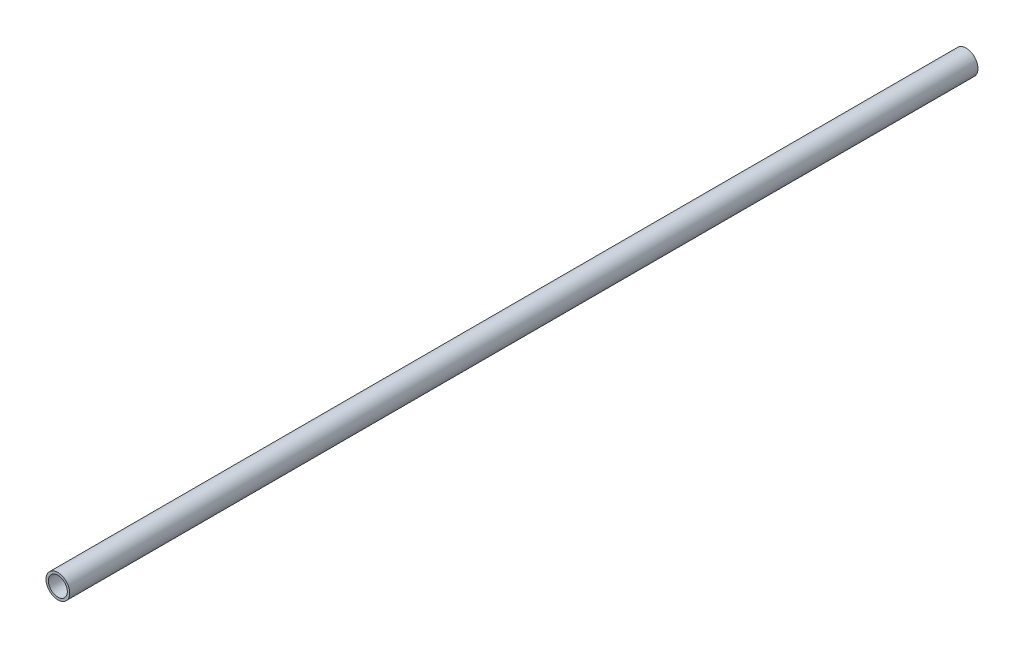
from build123d import *

# Parameters (mm, degrees)
SKETCH1_R           = 16.7005
SKETCH1_R_2         = 13.3223
BOSS_EXTRUDE1_DEPTH = 1278.128


with BuildPart() as part:
    # Sketch1 → Boss-Extrude1 (new body)
    with BuildSketch(Plane.XY):
        Circle(SKETCH1_R)
        Circle(SKETCH1_R_2, mode=Mode.SUBTRACT)
    extrude(amount=-BOSS_EXTRUDE1_DEPTH)


solid = part.part
